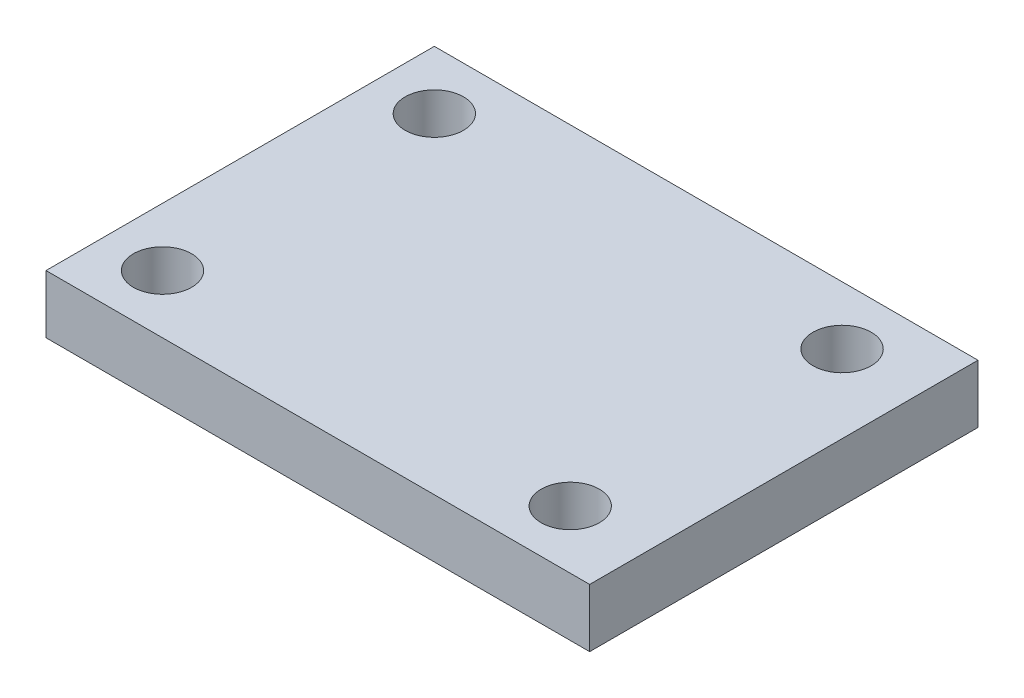
from build123d import *

# Parameters (mm, degrees)
SKETCH1_W           = 28
SKETCH1_H           = 20
SKETCH1_R           = 1.5
BOSS_EXTRUDE1_DEPTH = 3


with BuildPart() as part:
    # Sketch1 → Boss-Extrude1 (new body)
    with BuildSketch(Plane(origin=(0, 0, 0), x_dir=(1, 0, 0), z_dir=(0, 1, 0))):
        Rectangle(SKETCH1_W, SKETCH1_H)
        with Locations(Location((10, -7, 0), (0, 0, 270))):
            Circle(SKETCH1_R, mode=Mode.SUBTRACT)
        with Locations(Location((-11, -7, 0), (0, 0, 270))):
            Circle(SKETCH1_R, mode=Mode.SUBTRACT)
        with Locations(Location((10, 7, 0), (0, 0, 270))):
            Circle(SKETCH1_R, mode=Mode.SUBTRACT)
        with Locations(Location((-11, 7, 0), (0, 0, 270))):
            Circle(SKETCH1_R, mode=Mode.SUBTRACT)
    extrude(amount=BOSS_EXTRUDE1_DEPTH)


solid = part.part
